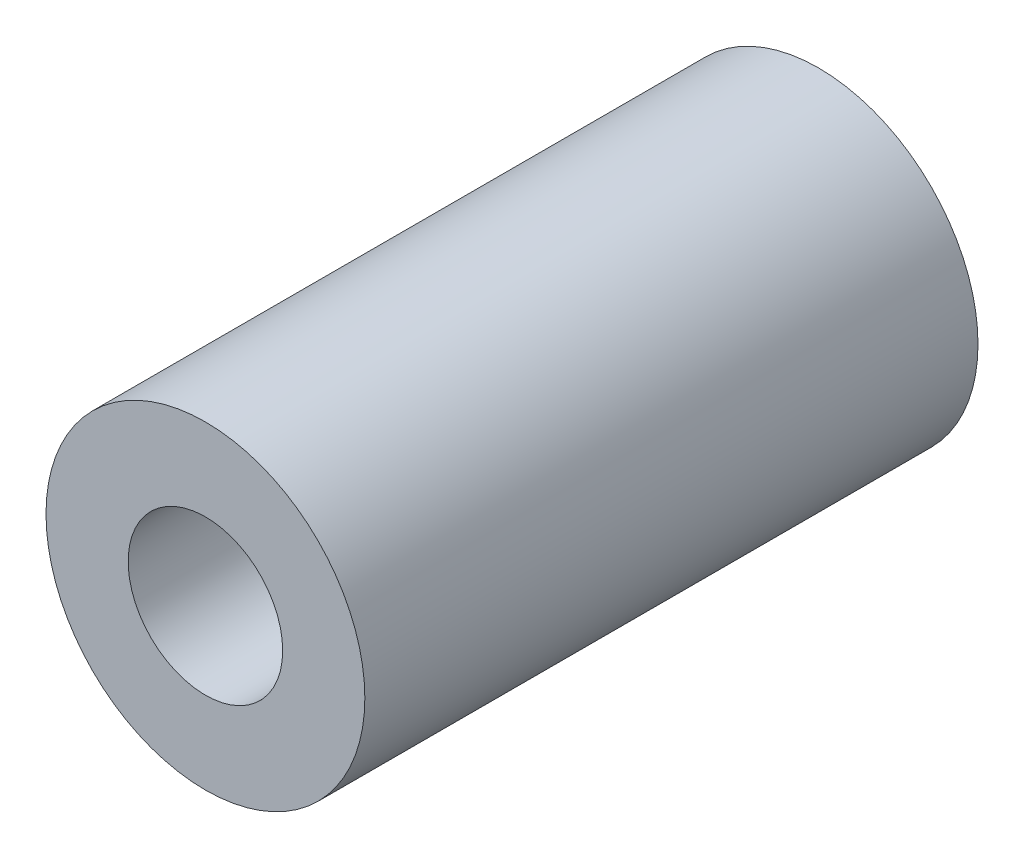
from build123d import *

# Parameters (mm, degrees)
EXTRUDE1_DEPTH      = 12.5
EXTRUDE1_DEPTH_BACK = 12.5
SKETCH1_R           = 6.5
SKETCH1_R_2         = 3.15


with BuildPart() as part:
    # Sketch1 → Extrude1 (new, two sides: drawn at the far end of the back side and taken through both)
    with BuildSketch(Plane.XY.offset(-EXTRUDE1_DEPTH_BACK)):
        Circle(SKETCH1_R)
        Circle(SKETCH1_R_2, mode=Mode.SUBTRACT)
    extrude(amount=EXTRUDE1_DEPTH + EXTRUDE1_DEPTH_BACK)


solid = part.part
